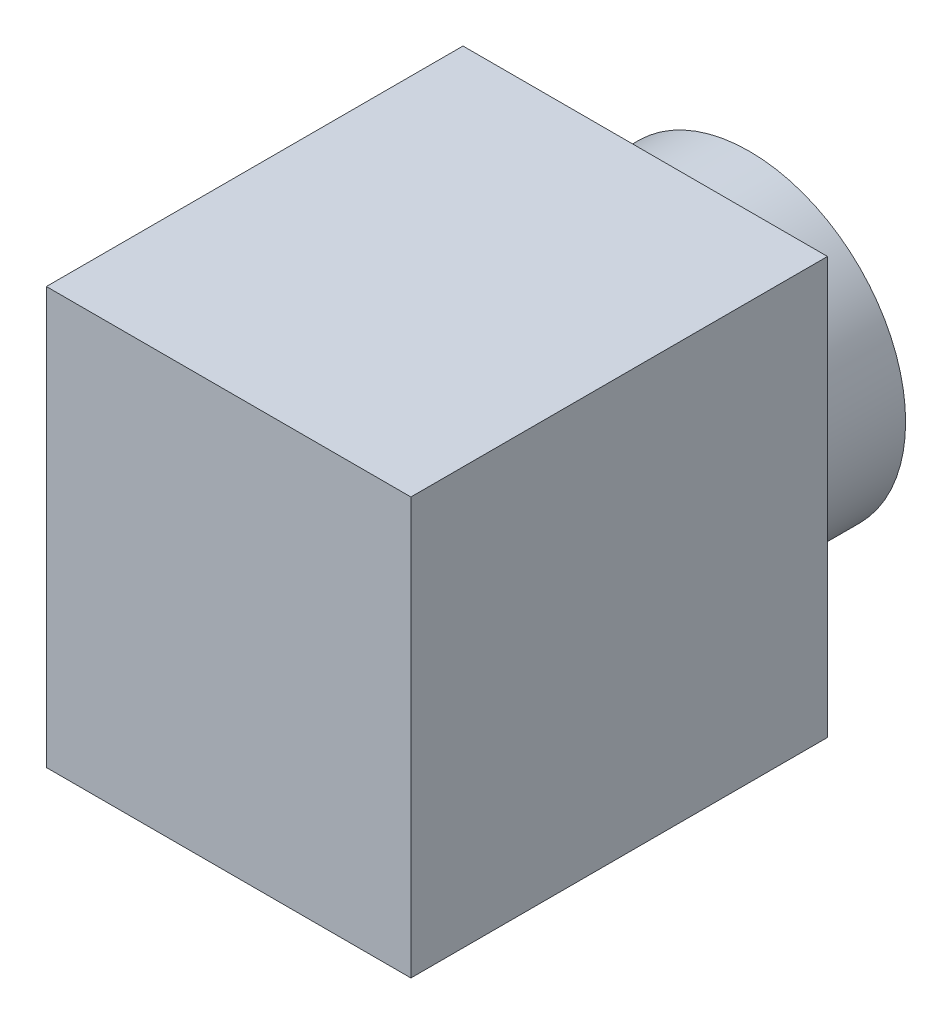
from build123d import *

# Parameters (mm, degrees)
CROQUIS1_W              = 70
CROQUIS1_H              = 80
SALIENTE_EXTRUIR1_DEPTH = 80
CROQUIS2_R              = 30
SALIENTE_EXTRUIR2_DEPTH = 20
CROQUIS3_R              = 21
CORTAR_EXTRUIR1_DEPTH   = 15


with BuildPart() as part:
    # Croquis1 → Saliente-Extruir1 (new body)
    with BuildSketch(Plane.XY):
        with Locations((35, 40)):
            Rectangle(CROQUIS1_W, CROQUIS1_H)
    extrude(amount=SALIENTE_EXTRUIR1_DEPTH)

    # Croquis2 → Saliente-Extruir2 (add)
    with BuildSketch(Plane(origin=(0, 0, 0), x_dir=(-1, 0, 0), z_dir=(0, 0, -1))):
        with Locations((-35, 40)):
            Circle(CROQUIS2_R)
    extrude(amount=SALIENTE_EXTRUIR2_DEPTH)

    # Croquis3 → Cortar-Extruir1 (cut)
    with BuildSketch(Plane.ZY):
        with Locations((40, 40)):
            Circle(CROQUIS3_R)
    extrude(amount=-CORTAR_EXTRUIR1_DEPTH, mode=Mode.SUBTRACT)


solid = part.part
